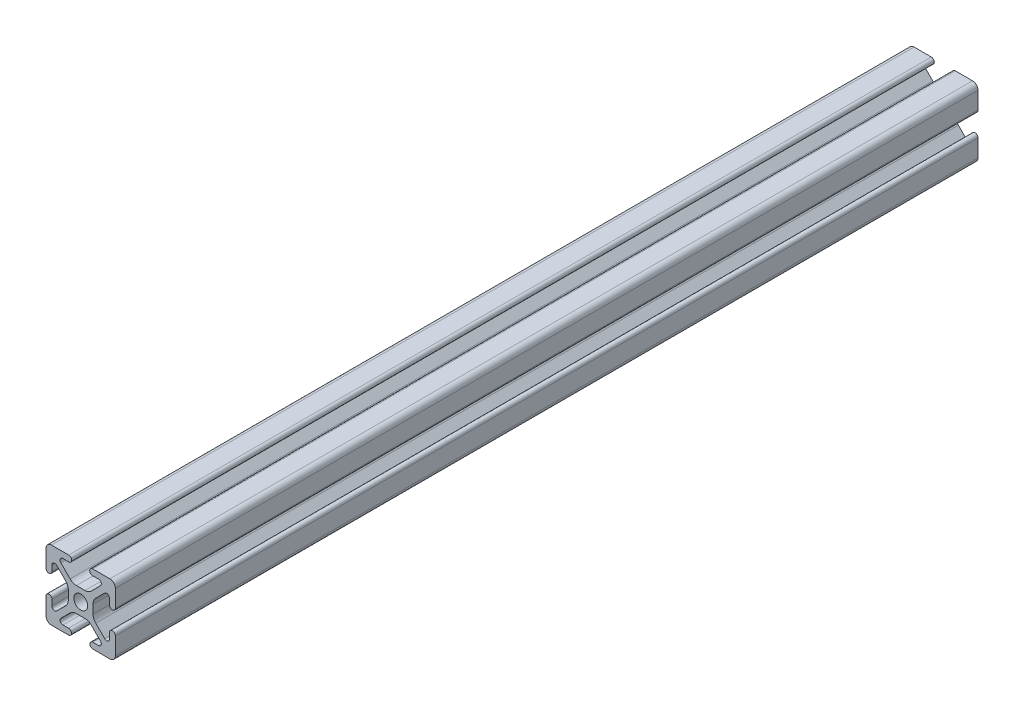
from build123d import *

# Parameters (mm, degrees)
SKETCH1_R      = 2.5
EXTRUDE1_DEPTH = 310.7516


with BuildPart() as part:
    # Sketch1 → Extrude1 (new body)
    with BuildSketch(Plane.XY):
        with BuildLine():
            Line((-8.636346088, 7.111588351), (-5.432204773, 3.912143135))
            ThreePointArc((-5.432204773, 3.912143135), (-4.708985779, 2.831057106), (-4.455, 1.555406707))
            Line((-4.455, 1.555406707), (-4.455, -1.555406707))
            ThreePointArc((-4.455, -1.555406707), (-4.708985779, -2.831057106), (-5.432204773, -3.912143135))
            Line((-5.432204773, -3.912143135), (-8.636346088, -7.111588351))
            ThreePointArc((-8.636346088, -7.111588351), (-9.736852394, -7.329863489), (-10.36, -6.396886949))
            Line((-10.36, -6.396886949), (-10.36, -4.32))
            ThreePointArc((-10.36, -4.32), (-11.43, -3.25), (-12.5, -4.32))
            Line((-12.5, -4.32), (-12.5, -8.651801989))
            Line((-12.5, -8.651801989), (-12.5, -10.537068835))
            ThreePointArc((-12.5, -10.537068835), (-11.925070773, -11.925070773), (-10.537068835, -12.5))
            Line((-10.537068835, -12.5), (-8.441567612, -12.5))
            Line((-8.441567612, -12.5), (-4.387856959, -12.5))
            ThreePointArc((-4.387856959, -12.5), (-3.317856959, -11.43), (-4.387856959, -10.36))
            Line((-4.387856959, -10.36), (-6.42, -10.36))
            ThreePointArc((-6.42, -10.36), (-7.35325999, -9.736168088), (-7.133653912, -8.635298598))
            Line((-7.133653912, -8.635298598), (-3.795290766, -5.301828272))
            ThreePointArc((-3.795290766, -5.301828272), (-2.76743922, -4.61585726), (-1.555406707, -4.375))
            Line((-1.555406707, -4.375), (1.555406707, -4.375))
            ThreePointArc((1.555406707, -4.375), (2.76743922, -4.61585726), (3.795290766, -5.301828272))
            Line((3.795290766, -5.301828272), (7.133653912, -8.635298598))
            ThreePointArc((7.133653912, -8.635298598), (7.35325999, -9.736168088), (6.42, -10.36))
            Line((6.42, -10.36), (4.387856959, -10.36))
            ThreePointArc((4.387856959, -10.36), (3.317856959, -11.43), (4.387856959, -12.5))
            Line((4.387856959, -12.5), (8.441567612, -12.5))
            Line((8.441567612, -12.5), (10.537068835, -12.5))
            ThreePointArc((10.537068835, -12.5), (11.925070773, -11.925070773), (12.5, -10.537068835))
            Line((12.5, -10.537068835), (12.5, -8.651801989))
            Line((12.5, -8.651801989), (12.5, -4.32))
            ThreePointArc((12.5, -4.32), (11.43, -3.25), (10.36, -4.32))
            Line((10.36, -4.32), (10.36, -6.396886949))
            ThreePointArc((10.36, -6.396886949), (9.736852394, -7.329863489), (8.636346088, -7.111588351))
            Line((8.636346088, -7.111588351), (5.432204773, -3.912143135))
            ThreePointArc((5.432204773, -3.912143135), (4.708985779, -2.831057106), (4.455, -1.555406707))
            Line((4.455, -1.555406707), (4.455, 1.555406707))
            ThreePointArc((4.455, 1.555406707), (4.708985779, 2.831057106), (5.432204773, 3.912143135))
            Line((5.432204773, 3.912143135), (8.636346088, 7.111588351))
            ThreePointArc((8.636346088, 7.111588351), (9.736852394, 7.329863489), (10.36, 6.396886949))
            Line((10.36, 6.396886949), (10.36, 4.32))
            ThreePointArc((10.36, 4.32), (11.43, 3.25), (12.5, 4.32))
            Line((12.5, 4.32), (12.5, 7.99129648))
            Line((12.5, 7.99129648), (12.5, 10.537068835))
            ThreePointArc((12.5, 10.537068835), (11.925070773, 11.925070773), (10.537068835, 12.5))
            Line((10.537068835, 12.5), (4.32, 12.5))
            ThreePointArc((4.32, 12.5), (3.25, 11.43), (4.32, 10.36))
            Line((4.32, 10.36), (6.42, 10.36))
            ThreePointArc((6.42, 10.36), (7.35325999, 9.736168088), (7.133653912, 8.635298598))
            Line((7.133653912, 8.635298598), (3.795290766, 5.301828272))
            ThreePointArc((3.795290766, 5.301828272), (2.76743922, 4.61585726), (1.555406707, 4.375))
            Line((1.555406707, 4.375), (-1.555406707, 4.375))
            ThreePointArc((-1.555406707, 4.375), (-2.76743922, 4.61585726), (-3.795290766, 5.301828272))
            Line((-3.795290766, 5.301828272), (-7.133653912, 8.635298598))
            ThreePointArc((-7.133653912, 8.635298598), (-7.35325999, 9.736168088), (-6.42, 10.36))
            Line((-6.42, 10.36), (-4.32, 10.36))
            ThreePointArc((-4.32, 10.36), (-3.25, 11.43), (-4.32, 12.5))
            Line((-4.32, 12.5), (-10.537068835, 12.5))
            ThreePointArc((-10.537068835, 12.5), (-11.925070773, 11.925070773), (-12.5, 10.537068835))
            Line((-12.5, 10.537068835), (-12.5, 7.99129648))
            Line((-12.5, 7.99129648), (-12.5, 4.32))
            ThreePointArc((-12.5, 4.32), (-11.43, 3.25), (-10.36, 4.32))
            Line((-10.36, 4.32), (-10.36, 6.396886949))
            ThreePointArc((-10.36, 6.396886949), (-9.736852394, 7.329863489), (-8.636346088, 7.111588351))
        make_face()
        Circle(SKETCH1_R, mode=Mode.SUBTRACT)
    extrude(amount=-EXTRUDE1_DEPTH)


solid = part.part
